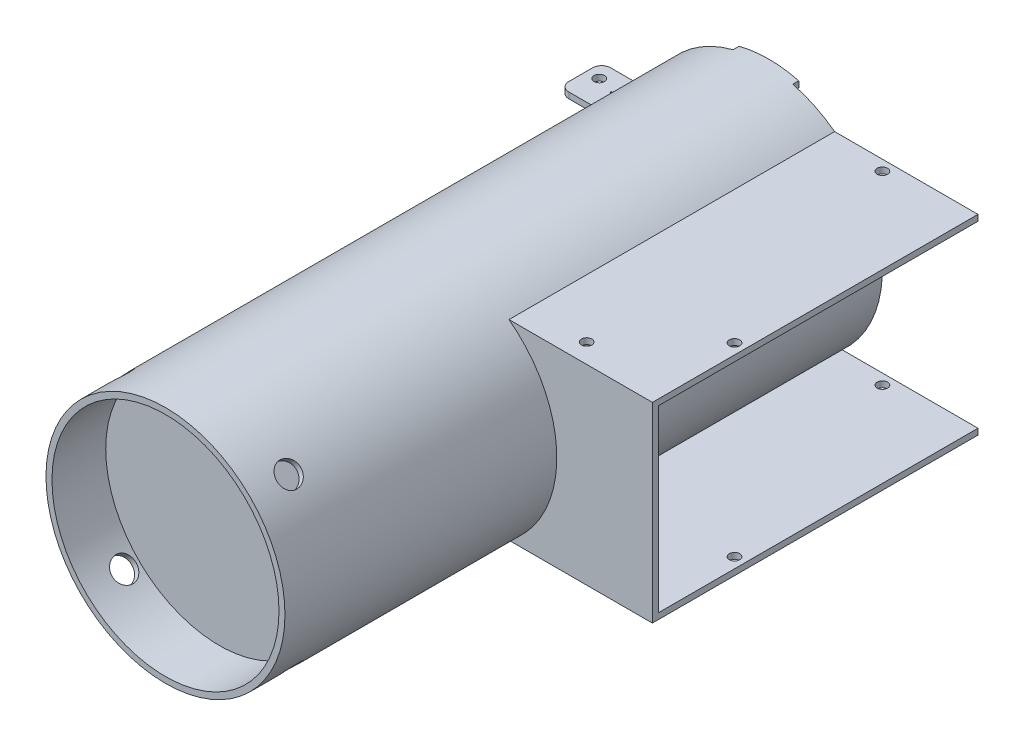
from build123d import *
from build123d.topology import SkipClean

# Parameters (mm, degrees)
SKETCH1_R                      = 40
SKETCH1_R_2                    = 38
BOSS_EXTRUDE1_DEPTH            = 200
SKETCH2_R                      = 40
BOSS_EXTRUDE2_DEPTH            = 2
BOSS_EXTRUDE3_DEPTH            = 107
BOSS_EXTRUDE4_DEPTH            = 2
SKETCH5_R                      = 1.75
CUT_EXTRUDE1_DEPTH             = 225.428162226
CUT_EXTRUDE2_REACH             = 218.296
SKETCH6_R                      = 4
CUT_EXTRUDE2_DIRECTION_2_REACH = 218.296
CIRPATTERN1_COUNT              = 2
CIRPATTERN1_ANGLE              = 90
BOSS_EXTRUDE5_REACH            = 241.742
BOSS_EXTRUDE5_END_RADIUS       = 40
SKETCH7_W                      = 14
SKETCH7_H                      = 2
CUT_EXTRUDE3_REACH             = 221.073
SKETCH8_R                      = 1.75
FILLET1_R                      = 3
CUT_EXTRUDE4_REACH             = 220.598
SKETCH9_R                      = 0.25
BOSS_EXTRUDE6_START            = 2
BOSS_EXTRUDE6_DEPTH            = 2


with BuildPart() as part:
    # Sketch1 → Boss-Extrude1 (new body)
    with BuildSketch(Plane.XY):
        Circle(SKETCH1_R)
        Circle(SKETCH1_R_2, mode=Mode.SUBTRACT)
    extrude(amount=BOSS_EXTRUDE1_DEPTH)

    # Sketch2 → Boss-Extrude2 (add)
    with BuildSketch(Plane.XY.offset(180)):
        Circle(SKETCH2_R)
    extrude(amount=BOSS_EXTRUDE2_DEPTH)

    # Sketch3 → Boss-Extrude3 (add)
    with BuildSketch(Plane(origin=(0, 0, 0), x_dir=(-1, 0, 0), z_dir=(0, 0, -1))):
        with BuildLine():
            Line((-24, -32), (-72, -32))
            Line((-72, -32), (-72, -30))
            Line((-72, -30), (-26.457513111, -30))
            ThreePointArc((-26.457513111, -30), (-25.248567431, -31.024342744), (-24, -32))
        make_face()
        with BuildLine():
            Line((-24, 32), (-72, 32))
            Line((-72, 32), (-72, 30))
            Line((-72, 30), (-26.457513111, 30))
            ThreePointArc((-26.457513111, 30), (-25.248567431, 31.024342744), (-24, 32))
        make_face()
    extrude(amount=-BOSS_EXTRUDE3_DEPTH)

    # Sketch4 → Boss-Extrude4 (add)
    with BuildSketch(Plane.XY.offset(107)):
        with BuildLine():
            Line((72, -32), (24, -32))
            ThreePointArc((24, -32), (40, 0), (24, 32))
            Line((24, 32), (72, 32))
            Line((72, 32), (72, -32))
        make_face()
    extrude(amount=BOSS_EXTRUDE4_DEPTH)

    # Sketch5 → Cut-Extrude1 (cut, through all)
    with BuildSketch(Plane(origin=(0, 32, 0), x_dir=(1, 0, 0), z_dir=(0, 1, 0))):
        with Locations(Location((43.5, -102.5, 0), (0, 0, 270))):
            Circle(SKETCH5_R)
        with Locations(Location((43.5, -3.5, 0), (0, 0, 270))):
            Circle(SKETCH5_R)
        with Locations(Location((68.5, -78, 0), (0, 0, 270))):
            Circle(SKETCH5_R)
    extrude(amount=-CUT_EXTRUDE1_DEPTH, mode=Mode.SUBTRACT)

    # Sketch6 → Cut-Extrude2 (cut, up to next)
    with BuildSketch(Plane(origin=(0, 0, 0), x_dir=(0, 0, 1), z_dir=(-0.7071067811865488, 0.7071067811865464, 0)), mode=Mode.PRIVATE) as cut_extrude2_sk1:
        with Locations(Location((187, 0, 0), (0, 0, 90))):
            Circle(SKETCH6_R)
    cut_extrude2_tool1 = extrude(cut_extrude2_sk1.sketch, amount=-CUT_EXTRUDE2_REACH, mode=Mode.PRIVATE) & part.part
    cut_extrude2 = cut_extrude2_tool1.solids().sort_by_distance((0, 0, 187))[0]
    add(cut_extrude2, mode=Mode.SUBTRACT)

    # Sketch6 → Cut-Extrude2 direction 2 (cut, up to next)
    with BuildSketch(Plane(origin=(0, 0, 0), x_dir=(0, 0, 1), z_dir=(-0.7071067811865488, 0.7071067811865464, 0)), mode=Mode.PRIVATE) as cut_extrude2_direction_2_sk1:
        with Locations(Location((187, 0, 0), (0, 0, 90))):
            Circle(SKETCH6_R)
    cut_extrude2_direction_2_tool1 = extrude(cut_extrude2_direction_2_sk1.sketch, amount=CUT_EXTRUDE2_DIRECTION_2_REACH, mode=Mode.PRIVATE) & part.part
    cut_extrude2_direction_2 = cut_extrude2_direction_2_tool1.solids().sort_by_distance((0, 0, 187))[0]
    add(cut_extrude2_direction_2, mode=Mode.SUBTRACT)

    # CirPattern1: Cut-Extrude2, Cut-Extrude2 direction 2 ×2 about axis
    cirpattern1_axis = Axis((0, 0, -12.1), (0, 0, 1))
    add([cut_extrude2.rotate(cirpattern1_axis, i * CIRPATTERN1_ANGLE / (CIRPATTERN1_COUNT - 1)) for i in range(1, CIRPATTERN1_COUNT)], mode=Mode.SUBTRACT)
    add([cut_extrude2_direction_2.rotate(cirpattern1_axis, i * CIRPATTERN1_ANGLE / (CIRPATTERN1_COUNT - 1)) for i in range(1, CIRPATTERN1_COUNT)], mode=Mode.SUBTRACT)

    # Boss-Extrude5: up to this cylinder (the profile starts outside it)
    boss_extrude5_end = Plane(origin=(0, 0, 7), z_dir=(0, 0, -1)) * Cylinder(BOSS_EXTRUDE5_END_RADIUS, 564.484, mode=Mode.PRIVATE)
    # Sketch7 → Boss-Extrude5 (add, up to the surface)
    with BuildSketch(Plane(origin=(-54, 0, 0), x_dir=(0, 0, -1), z_dir=(1, 0, 0)), mode=Mode.PRIVATE) as boss_extrude5_sk1:
        with Locations((-7, -12)):
            Rectangle(SKETCH7_W, SKETCH7_H)
    boss_extrude5_tool1 = extrude(boss_extrude5_sk1.sketch, amount=BOSS_EXTRUDE5_REACH, mode=Mode.PRIVATE) - boss_extrude5_end
    add(boss_extrude5_tool1.solids().sort_by_distance((-54, -12, 7))[0])
    # Sketch7 → Boss-Extrude5 (add, up to the surface)
    with BuildSketch(Plane(origin=(-54, 0, 0), x_dir=(0, 0, -1), z_dir=(1, 0, 0)), mode=Mode.PRIVATE) as boss_extrude5_sk2:
        with Locations((-7, 12)):
            Rectangle(SKETCH7_W, SKETCH7_H)
    boss_extrude5_tool2 = extrude(boss_extrude5_sk2.sketch, amount=BOSS_EXTRUDE5_REACH, mode=Mode.PRIVATE) - boss_extrude5_end
    add(boss_extrude5_tool2.solids().sort_by_distance((-54, 12, 7))[0])

    # Cut-Extrude3: up to this face of the body (flat: up to its plane)
    cut_extrude3_end = Plane(part.part.faces().sort_by_distance((-45.914280319, 13, 7))[0])
    # Sketch8 → Cut-Extrude3 (cut, up to the picked face)
    with BuildSketch(Plane.XZ.offset(13), mode=Mode.PRIVATE) as cut_extrude3_sk1:
        with Locations(Location((-49.770305539, 5.008755099, 0), (0, 0, 270))):
            Circle(SKETCH8_R)
    cut_extrude3_tool1 = split(extrude(cut_extrude3_sk1.sketch, amount=-CUT_EXTRUDE3_REACH, mode=Mode.PRIVATE), bisect_by=cut_extrude3_end, keep=Keep.BOTH, mode=Mode.PRIVATE)
    add(cut_extrude3_tool1.solids().sort_by(Axis((-49.770306, -13, 5.008755), (0, 1, 0)))[0], mode=Mode.SUBTRACT)

    # Fillet1
    fillet1_edges = [part.edges().sort_by_distance(p)[0] for p in [
        (-54, -12, 14),
        (-54, -12, 0),
        (-54, 12, 0),
        (-54, 12, 14),
    ]]
    fillet(fillet1_edges, radius=FILLET1_R)

    # Sketch9 → Cut-Extrude4 (cut, up to next)
    with BuildSketch(Plane.XZ.offset(-11), mode=Mode.PRIVATE) as cut_extrude4_sk1:
        with Locations(Location((-43.770305539, 7.008755099, 0), (0, 0, 270))):
            Circle(SKETCH9_R)
    cut_extrude4_tool1 = extrude(cut_extrude4_sk1.sketch, amount=-CUT_EXTRUDE4_REACH, mode=Mode.PRIVATE) & part.part
    add(cut_extrude4_tool1.solids().sort_by_distance((-43.770306, 11, 7.008755))[0], mode=Mode.SUBTRACT)

    # Sketch10 → Boss-Extrude6 (add)
    with SkipClean():  # the faces are left unmerged after this step: merging them gives an invalid solid
        with BuildSketch(Plane(origin=(0, 0, 0), x_dir=(-1, 0, 0), z_dir=(0, 0, -1)).offset(BOSS_EXTRUDE6_START)):
            with BuildLine():
                ThreePointArc((10, -36.66060556), (0, -38), (-10, -36.66060556))
                Line((-10, -36.66060556), (-10, -38.729833462))
                ThreePointArc((-10, -38.729833462), (0, -40), (10, -38.729833462))
                Line((10, -38.729833462), (10, -36.66060556))
            make_face()
            with BuildLine():
                ThreePointArc((10, 38.729833462), (0, 40), (-10, 38.729833462))
                Line((-10, 38.729833462), (-10, 36.66060556))
                ThreePointArc((-10, 36.66060556), (0, 38), (10, 36.66060556))
                Line((10, 36.66060556), (10, 38.729833462))
            make_face()
        extrude(amount=-BOSS_EXTRUDE6_DEPTH)


solid = part.part
